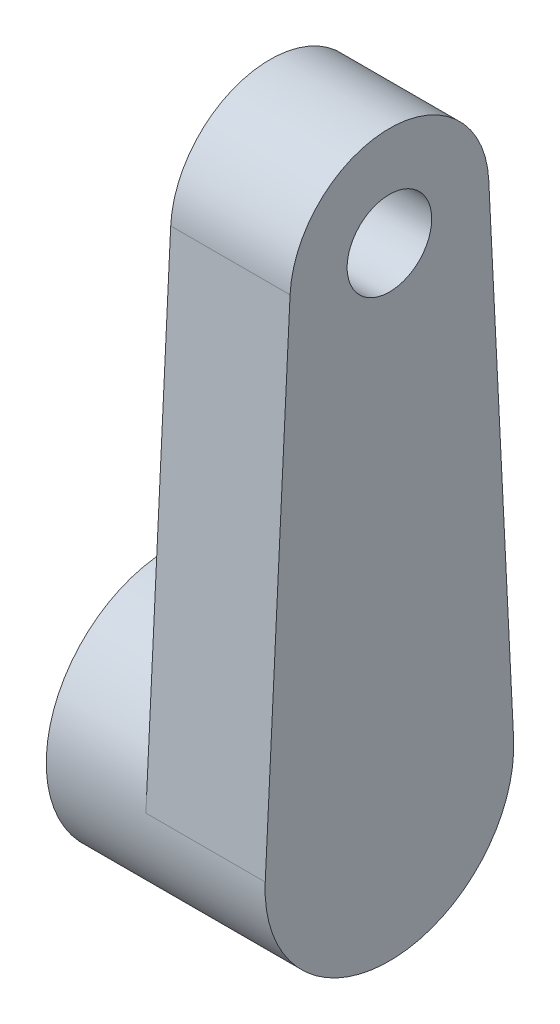
from build123d import *

# Parameters (mm, degrees)
CROQUIS1_R              = 12.5
SALIENTE_EXTRUIR1_DEPTH = 10
SALIENTE_EXTRUIR2_DEPTH = 12
CROQUIS3_R              = 2.25
CORTAR_EXTRUIR1_DEPTH   = 66.117202028
CROQUIS4_R              = 4.25
CORTAR_EXTRUIR2_DEPTH   = 66.117202081


with BuildPart() as part:
    # Croquis1 → Saliente-Extruir1 (new body)
    with BuildSketch(Plane(origin=(0, 0, 0), x_dir=(0, 0, -1), z_dir=(1, 0, 0))):
        Circle(CROQUIS1_R)
        with BuildLine():
            Line((-1.658312395, -2.5), (1.658312395, -2.5))
            ThreePointArc((1.658312395, -2.5), (0, 3), (-1.658312395, -2.5))
        make_face(mode=Mode.SUBTRACT)
    extrude(amount=SALIENTE_EXTRUIR1_DEPTH)

    # Croquis2 → Saliente-Extruir2 (add)
    with BuildSketch(Plane(origin=(10, 0, 0), x_dir=(0, 0, -1), z_dir=(1, 0, 0))):
        with BuildLine():
            Line((-9.987492178, 50.5), (-12.484365222, 0.625))
            ThreePointArc((-12.484365222, 0.625), (0, -12.5), (12.484365222, 0.625))
            Line((12.484365222, 0.625), (9.987492178, 50.5))
            ThreePointArc((9.987492178, 50.5), (0, 60), (-9.987492178, 50.5))
        make_face()
    extrude(amount=SALIENTE_EXTRUIR2_DEPTH)

    # Croquis3 → Cortar-Extruir1 (cut, through all)
    with BuildSketch(Plane(origin=(0, 0, 0), x_dir=(1, 0, 0), z_dir=(0, 1, 0))):
        with Locations(Location((5, 0, 0), (0, 0, 227.478835592))):
            Circle(CROQUIS3_R)
    extrude(amount=-CORTAR_EXTRUIR1_DEPTH, mode=Mode.SUBTRACT)

    # Croquis4 → Cortar-Extruir2 (cut, through all)
    with BuildSketch(Plane(origin=(22, 0, 0), x_dir=(0, 0, -1), z_dir=(1, 0, 0))):
        with Locations((0, 50)):
            Circle(CROQUIS4_R)
    extrude(amount=-CORTAR_EXTRUIR2_DEPTH, mode=Mode.SUBTRACT)


solid = part.part
